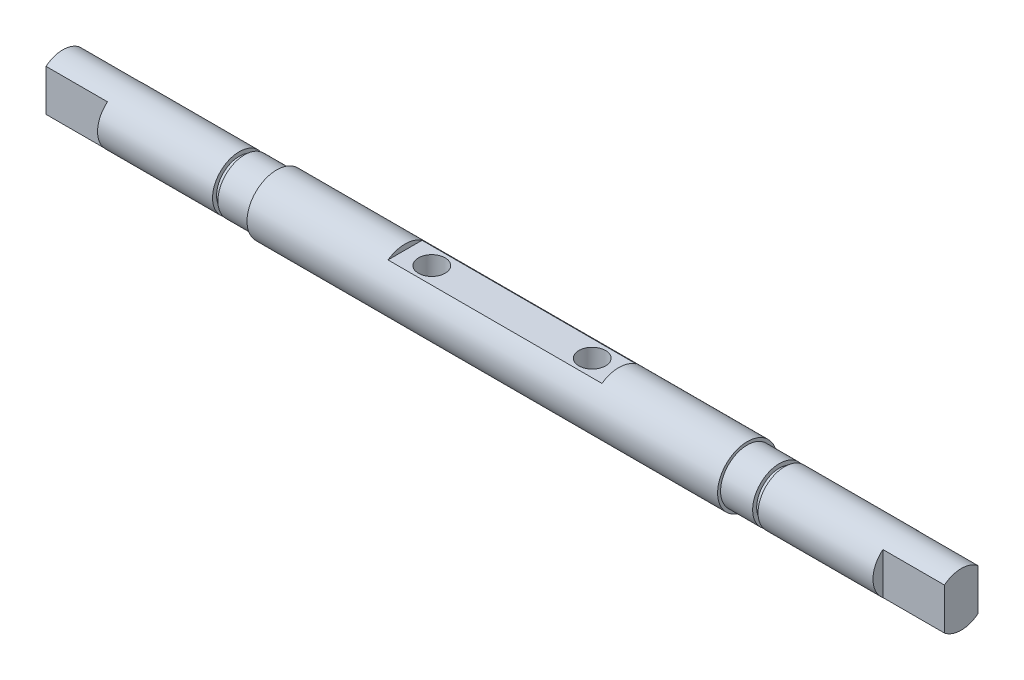
from build123d import *

# Parameters (mm, degrees)
CORTAR_EXTRUIR1_START      = -23
CORTAR_EXTRUIR1_DEPTH      = 23
CORTAR_EXTRUIR2_DEPTH      = 238.026751177
CORTAR_EXTRUIR2_DEPTH_BACK = 238.026751177
CROQUIS3_W                 = 80
CROQUIS3_H                 = 4
CROQUIS4_R                 = 5
CORTAR_EXTRUIR3_DEPTH      = 238.628373184


with BuildPart() as part:
    # Croquis1 → Revolución1 (revolve)
    with BuildSketch(Plane.XY, mode=Mode.PRIVATE) as revoluci_n1_sk:
        Polygon((-19.494808808, 11.1125), (68.505191192, 11.1125), (68.505191192, 0), (-99.494808808, 0), (-99.494808808, 10), (-33.494808808, 10), (-33.494808808, 8.5), (-31.494808808, 8.5), (-31.494808808, 10), (-19.494808808, 10), align=None)
    revoluci_n1 = revolve(revoluci_n1_sk.sketch.rotate(Axis((70.414965315, 0, 0), (-1, 0, 0)), 90), axis=Axis((70.414965315, 0, 0), (-1, 0, 0)))

    # Croquis2 → Cortar-Extruir1 (cut)
    with BuildSketch(Plane.ZY.offset(99.494808808).offset(CORTAR_EXTRUIR1_START)):
        with BuildLine():
            Line((-6.278365003, -7.783452504), (-6.278365003, 7.783452504))
            ThreePointArc((-6.278365003, 7.783452504), (-10, 0), (-6.278365003, -7.783452504))
        make_face()
        with BuildLine():
            Line((6.278365003, -7.783452504), (6.278365003, 7.783452504))
            ThreePointArc((6.278365003, 7.783452504), (10, 0), (6.278365003, -7.783452504))
        make_face()
    cortar_extruir1 = extrude(amount=CORTAR_EXTRUIR1_DEPTH, mode=Mode.SUBTRACT)

    # Simetría2: Revolución1, Cortar-Extruir1 across plane
    add(revoluci_n1.mirror(Plane(origin=(68.505191192, 11.1125, 0), x_dir=(0, 0, 1), z_dir=(1, 0, 0))))
    add(cortar_extruir1.mirror(Plane(origin=(68.505191192, 11.1125, 0), x_dir=(0, 0, 1), z_dir=(1, 0, 0))), mode=Mode.SUBTRACT)

    # Croquis3 → Cortar-Extruir2 (cut, two sides: drawn at the far end of the back side and taken through both)
    with BuildSketch(Plane.XY.offset(-CORTAR_EXTRUIR2_DEPTH_BACK)):
        with Locations((68.505191192, 11.1125)):
            Rectangle(CROQUIS3_W, CROQUIS3_H)
        with Locations((68.505191192, -11.1125)):
            Rectangle(CROQUIS3_W, CROQUIS3_H)
    extrude(amount=CORTAR_EXTRUIR2_DEPTH + CORTAR_EXTRUIR2_DEPTH_BACK, mode=Mode.SUBTRACT)

    # Croquis4 → Cortar-Extruir3 (cut, through all)
    with BuildSketch(Plane(origin=(0, 9.1125, 0), x_dir=(1, 0, 0), z_dir=(0, 1, 0))):
        with Locations(Location((38.505191192, 0, 0), (0, 0, 270))):
            Circle(CROQUIS4_R)
        with Locations(Location((98.505191192, 0, 0), (0, 0, 270))):
            Circle(CROQUIS4_R)
    extrude(amount=-CORTAR_EXTRUIR3_DEPTH, mode=Mode.SUBTRACT)


solid = part.part
